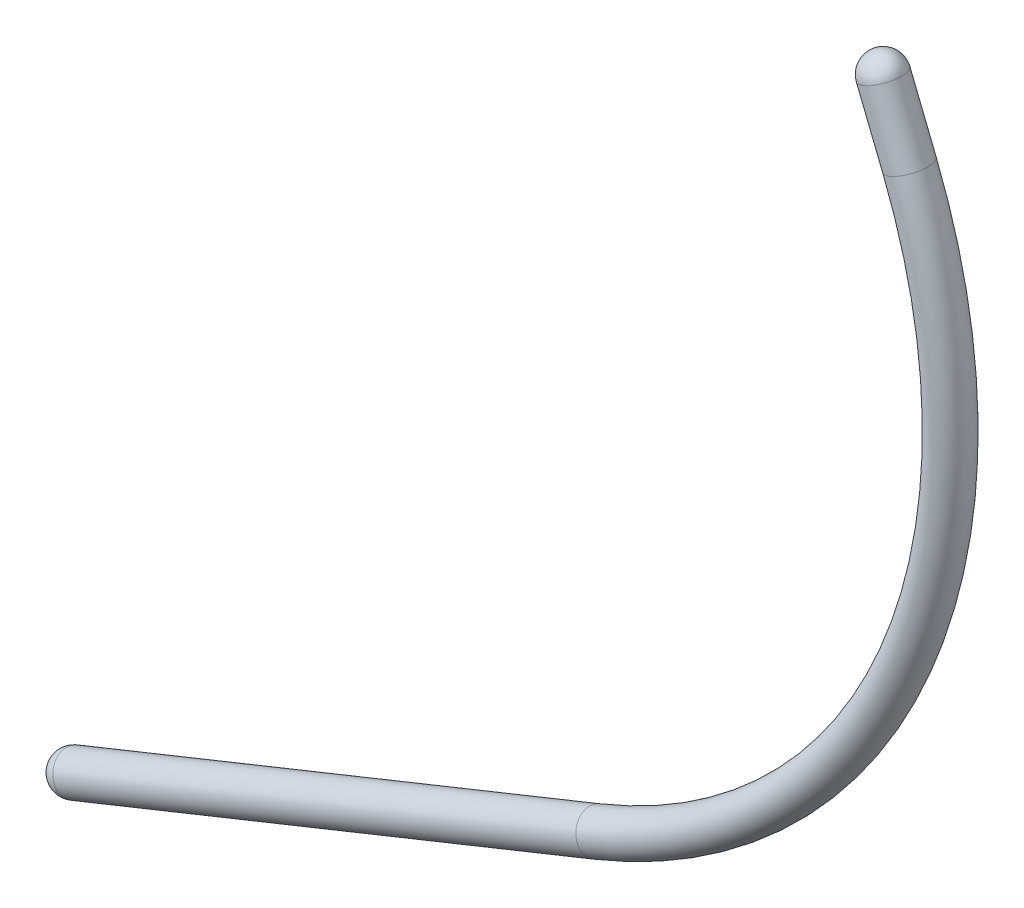
from build123d import *

# Parameters (mm, degrees)
SKETCH_3_R = 1.4


with BuildPart() as part:
    # 扫描1: sweep along a path in 草图2
    with BuildLine(Plane.XY) as sweep_1_path:
        Line((-22.258775921, 79.972270587), (-20.392109255, 75.333784243))
        ThreePointArc((-20.392109255, 75.333784243), (-20.701297553, 44.720670994), (-42.566666667, 23.292560165))
        Line((-42.566666667, 23.292560165), (-79.674557412, 8.359226832))
    # 草图3 → 扫描1 (sweep)
    with BuildSketch(Plane(origin=(-79.674557412, 8.359226832, 0), x_dir=(0, 0, 1), z_dir=(-0.9276972686292776, -0.3733333333333338, 0))):
        Circle(SKETCH_3_R)
    sweep(path=sweep_1_path.line)

    # 草图4 → 旋转1 (revolve)
    with BuildSketch(Plane(origin=(-65.674557412, -26.429420742, 0), x_dir=(0, 0, 1), z_dir=(-0.9276972686292776, -0.37333333333333385, 0))):
        with BuildLine():
            Line((0, 38.9), (0, 36.1))
            ThreePointArc((0, 36.1), (-1.4, 37.5), (0, 38.9))
        make_face()
    revolve(axis=Axis((-80.197224079, 9.658003008, 0), (0.37333333333333635, -0.9276972686292765, 0)))

    # 草图6 → 旋转2 (revolve)
    with BuildSketch(Plane(origin=(-30.8, 76.535024662, 0), x_dir=(0.9276972686292776, 0.37333333333333374, 0), z_dir=(-0.3733333333333337, 0.9276972686292775, 0))):
        with BuildLine():
            Line((7.806908727, 0), (10.606908727, 0))
            ThreePointArc((10.606908727, 0), (9.206908727, 1.4), (7.806908727, 0))
        make_face()
    revolve(axis=Axis((-23.557552098, 79.44960392, 0), (0.9276972686292784, 0.3733333333333317, 0)))


solid = part.part
